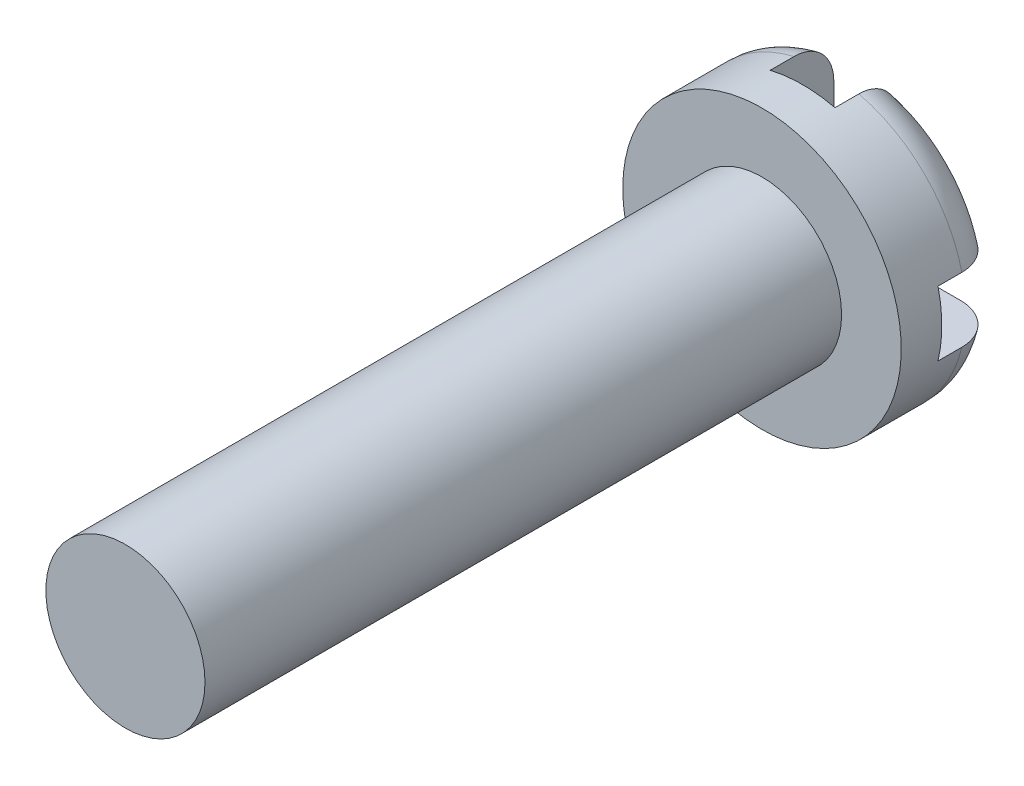
from build123d import *

# Parameters (mm, degrees)
SKETCH_1_R          = 1
EXTRUDE_1_DEPTH     = 8
SKETCH_2_R          = 1.75
EXTRUDE_2_DEPTH     = 1.31
FILLET_1_R          = 0.5
CUT_EXTRUDE_1_DEPTH = 0.8


with BuildPart() as part:
    # 草图1 → 凸台-拉伸1 (new body)
    with BuildSketch(Plane.XY):
        Circle(SKETCH_1_R)
    extrude(amount=EXTRUDE_1_DEPTH)

    # 草图2 → 凸台-拉伸2 (add)
    with BuildSketch(Plane(origin=(0, 0, 0), x_dir=(-1, 0, 0), z_dir=(0, 0, -1))):
        Circle(SKETCH_2_R)
    extrude(amount=EXTRUDE_2_DEPTH)

    # 圆角1
    fillet_1_edges = [part.edges().sort_by_distance(p)[0] for p in [
        (1.75, 0, -1.31),
    ]]
    fillet(fillet_1_edges, radius=FILLET_1_R)

    # 草图3 → 切除-拉伸1 (cut)
    with BuildSketch(Plane(origin=(0, 0, -1.31), x_dir=(-1, 0, 0), z_dir=(0, 0, -1))):
        Polygon((0.407106781, 0.407106781), (0.407106781, 5.706401657), (-0.407106781, 5.706401657), (-0.407106781, 0.407106781), (-5.706401657, 0.407106781), (-5.706401657, -0.407106781), (-0.407106781, -0.407106781), (-0.407106781, -5.706401657), (0.407106781, -5.706401657), (0.407106781, -0.407106781), (5.706401657, -0.407106781), (5.706401657, 0.407106781), align=None)
    extrude(amount=-CUT_EXTRUDE_1_DEPTH, mode=Mode.SUBTRACT)


solid = part.part
